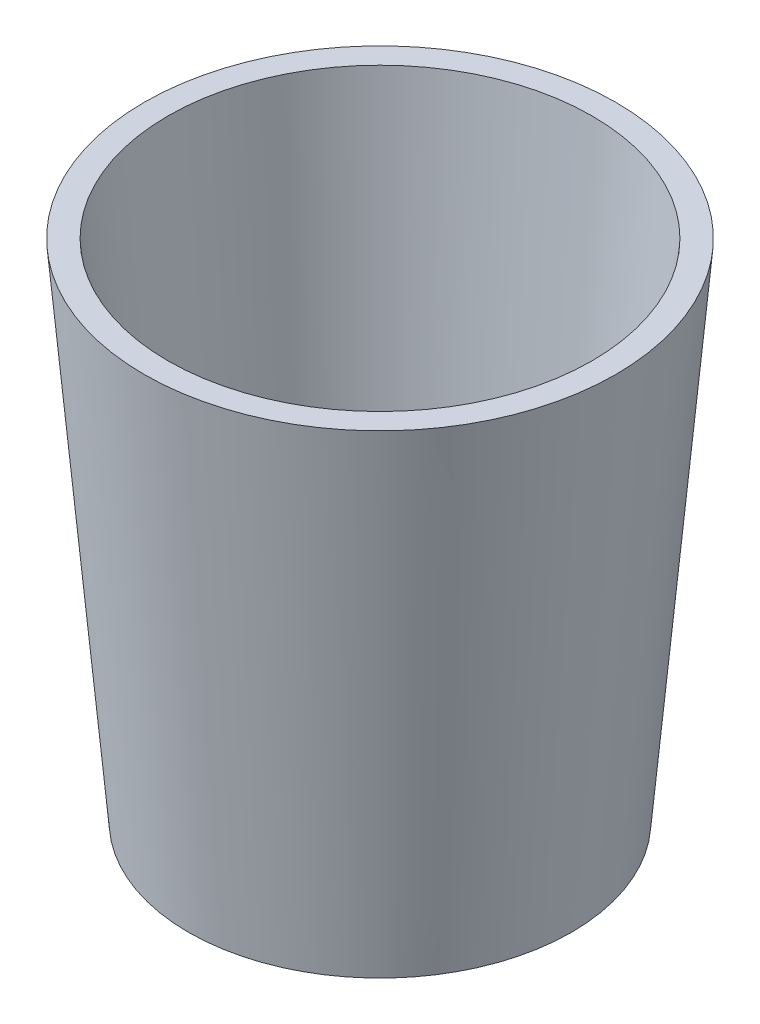
from build123d import *


with BuildPart() as part:
    # 草图1 → 旋转1 (revolve)
    with BuildSketch(Plane.XY, mode=Mode.PRIVATE) as revolve_1_sk:
        Polygon((0, 0), (56.876700471, 0), (56.876700471, 20), (5.276965592, 20), (-6.096560666, 150), (-13.123299529, 150), align=None)
    revolve(revolve_1_sk.sketch.rotate(Axis((56.876700471, 0, 0), (0, 1, 0)), 270), axis=Axis((56.876700471, 0, 0), (0, 1, 0)))


solid = part.part
